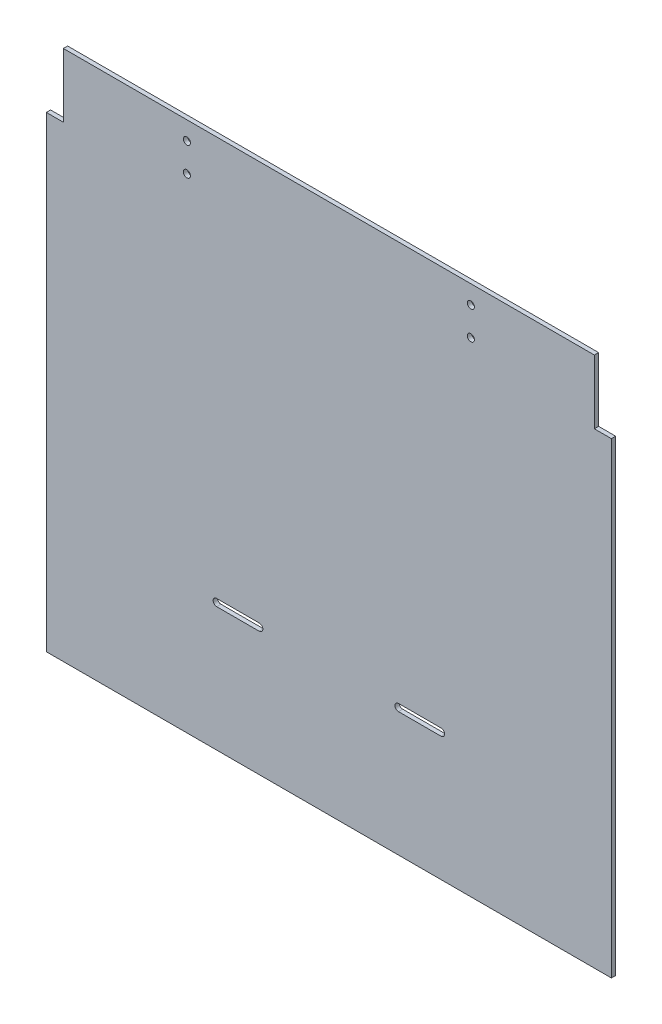
from build123d import *

# Parameters (mm, degrees)
SKETCH1_W           = 398
SKETCH1_H           = 374
BOSS_EXTRUDE1_DEPTH = 3
CUT_EXTRUDE1_REACH  = 275.092
SKETCH2_R           = 2.5
SKETCH2_W           = 12
SKETCH2_H           = 45
CUT_EXTRUDE2_REACH  = 275.092
SKETCH3_R           = 2.5
CUT_EXTRUDE3_DEPTH  = 274.091559738


with BuildPart() as part:
    # Sketch1 → Boss-Extrude1 (new body)
    with BuildSketch(Plane.XY):
        Rectangle(SKETCH1_W, SKETCH1_H)
    extrude(amount=BOSS_EXTRUDE1_DEPTH)

    # Sketch2 → Cut-Extrude1 (cut, up to next)
    with BuildSketch(Plane(origin=(0, 0, 0), x_dir=(-1, 0, 0), z_dir=(0, 0, -1)), mode=Mode.PRIVATE) as cut_extrude1_sk1:
        with Locations((-100, 174.06)):
            Circle(SKETCH2_R)
    cut_extrude1_tool1 = extrude(cut_extrude1_sk1.sketch, amount=-CUT_EXTRUDE1_REACH, mode=Mode.PRIVATE) & part.part
    # Sketch2 → Cut-Extrude1 (cut, up to next)
    with BuildSketch(Plane(origin=(0, 0, 0), x_dir=(-1, 0, 0), z_dir=(0, 0, -1)), mode=Mode.PRIVATE) as cut_extrude1_sk2:
        with Locations((-100, 154.06)):
            Circle(SKETCH2_R)
    cut_extrude1_tool2 = extrude(cut_extrude1_sk2.sketch, amount=-CUT_EXTRUDE1_REACH, mode=Mode.PRIVATE) & part.part
    # Sketch2 → Cut-Extrude1 (cut, up to next)
    with BuildSketch(Plane(origin=(0, 0, 0), x_dir=(-1, 0, 0), z_dir=(0, 0, -1)), mode=Mode.PRIVATE) as cut_extrude1_sk3:
        with Locations((100, 154.06)):
            Circle(SKETCH2_R)
    cut_extrude1_tool3 = extrude(cut_extrude1_sk3.sketch, amount=-CUT_EXTRUDE1_REACH, mode=Mode.PRIVATE) & part.part
    # Sketch2 → Cut-Extrude1 (cut, up to next)
    with BuildSketch(Plane(origin=(0, 0, 0), x_dir=(-1, 0, 0), z_dir=(0, 0, -1)), mode=Mode.PRIVATE) as cut_extrude1_sk4:
        with Locations((100, 174.06)):
            Circle(SKETCH2_R)
    cut_extrude1_tool4 = extrude(cut_extrude1_sk4.sketch, amount=-CUT_EXTRUDE1_REACH, mode=Mode.PRIVATE) & part.part
    # Sketch2 → Cut-Extrude1 (cut, up to next)
    with BuildSketch(Plane(origin=(0, 0, 0), x_dir=(-1, 0, 0), z_dir=(0, 0, -1)), mode=Mode.PRIVATE) as cut_extrude1_sk5:
        with Locations((-193, 164.5)):
            Rectangle(SKETCH2_W, SKETCH2_H)
    cut_extrude1_tool5 = extrude(cut_extrude1_sk5.sketch, amount=-CUT_EXTRUDE1_REACH, mode=Mode.PRIVATE) & part.part
    # Sketch2 → Cut-Extrude1 (cut, up to next)
    with BuildSketch(Plane(origin=(0, 0, 0), x_dir=(-1, 0, 0), z_dir=(0, 0, -1)), mode=Mode.PRIVATE) as cut_extrude1_sk6:
        with Locations((193, 164.5)):
            Rectangle(SKETCH2_W, SKETCH2_H)
    cut_extrude1_tool6 = extrude(cut_extrude1_sk6.sketch, amount=-CUT_EXTRUDE1_REACH, mode=Mode.PRIVATE) & part.part
    add(cut_extrude1_tool1.solids().sort_by_distance((100, 174.06, 0))[0], mode=Mode.SUBTRACT)
    add(cut_extrude1_tool2.solids().sort_by_distance((100, 154.06, 0))[0], mode=Mode.SUBTRACT)
    add(cut_extrude1_tool3.solids().sort_by_distance((-100, 154.06, 0))[0], mode=Mode.SUBTRACT)
    add(cut_extrude1_tool4.solids().sort_by_distance((-100, 174.06, 0))[0], mode=Mode.SUBTRACT)
    add(cut_extrude1_tool5.solids().sort_by_distance((193, 164.5, 0))[0], mode=Mode.SUBTRACT)
    add(cut_extrude1_tool6.solids().sort_by_distance((-193, 164.5, 0))[0], mode=Mode.SUBTRACT)

    # Sketch3 → Cut-Extrude2 (cut, up to next)
    with BuildSketch(Plane(origin=(0, 0, 0), x_dir=(-1, 0, 0), z_dir=(0, 0, -1)), mode=Mode.PRIVATE) as cut_extrude2_sk1:
        with Locations((64, -97)):
            Circle(SKETCH3_R)
    cut_extrude2_tool1 = extrude(cut_extrude2_sk1.sketch, amount=-CUT_EXTRUDE2_REACH, mode=Mode.PRIVATE) & part.part
    # Sketch3 → Cut-Extrude2 (cut, up to next)
    with BuildSketch(Plane(origin=(0, 0, 0), x_dir=(-1, 0, 0), z_dir=(0, 0, -1)), mode=Mode.PRIVATE) as cut_extrude2_sk2:
        with Locations((-64, -97)):
            Circle(SKETCH3_R)
    cut_extrude2_tool2 = extrude(cut_extrude2_sk2.sketch, amount=-CUT_EXTRUDE2_REACH, mode=Mode.PRIVATE) & part.part
    add(cut_extrude2_tool1.solids().sort_by_distance((-64, -97, 0))[0], mode=Mode.SUBTRACT)
    add(cut_extrude2_tool2.solids().sort_by_distance((64, -97, 0))[0], mode=Mode.SUBTRACT)

    # Sketch4 → Cut-Extrude3 (cut, through all)
    with BuildSketch(Plane(origin=(0, 0, 0), x_dir=(-1, 0, 0), z_dir=(0, 0, -1))):
        with BuildLine():
            Line((49, -94.5), (79, -94.5))
            ThreePointArc((79, -94.5), (81.5, -97), (79, -99.5))
            Line((79, -99.5), (49, -99.5))
            ThreePointArc((49, -99.5), (46.5, -97), (49, -94.5))
        make_face()
        with BuildLine():
            Line((-49, -94.5), (-79, -94.5))
            ThreePointArc((-79, -94.5), (-81.5, -97), (-79, -99.5))
            Line((-79, -99.5), (-49, -99.5))
            ThreePointArc((-49, -99.5), (-46.5, -97), (-49, -94.5))
        make_face()
    extrude(amount=-CUT_EXTRUDE3_DEPTH, mode=Mode.SUBTRACT)


solid = part.part
